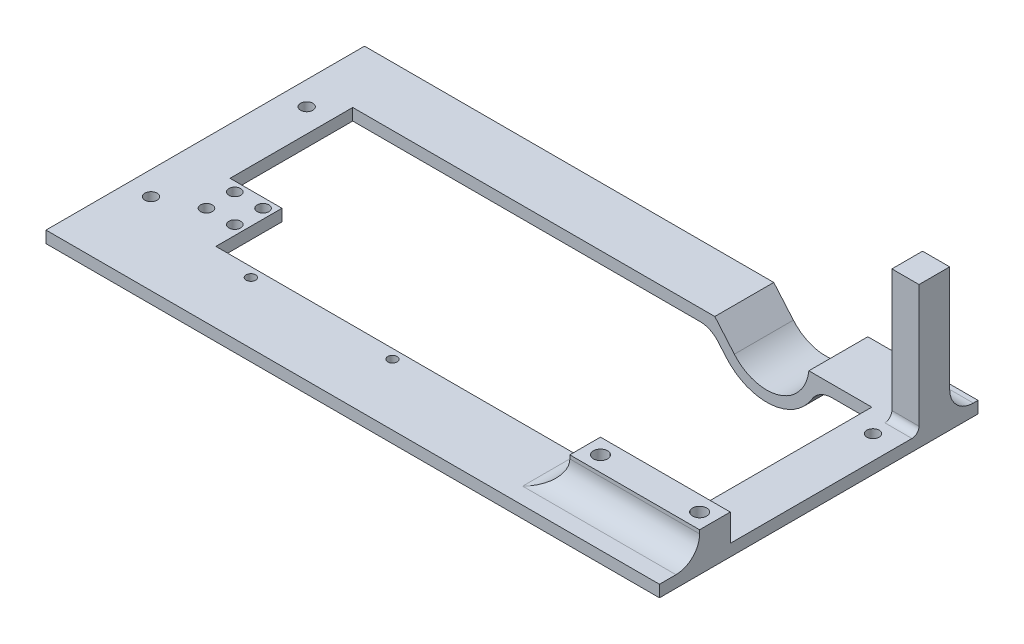
from build123d import *

# Parameters (mm, degrees)
BOSS_EXTRUDE1_DEPTH = 5
SKETCH2_W           = 55
SKETCH2_H           = 13
SKETCH2_R           = 3
BOSS_EXTRUDE2_DEPTH = 11.5
SKETCH3_W           = 11.5
SKETCH3_H           = 13
BOSS_EXTRUDE3_DEPTH = 55
BOSS_EXTRUDE4_DEPTH = 60
CUT_EXTRUDE1_DEPTH  = 35
SKETCH6_R           = 2.5
SKETCH6_R_2         = 2
CUT_EXTRUDE2_DEPTH  = 10
SKETCH7_R           = 2.6
CUT_EXTRUDE3_DEPTH  = 10
SKETCH8_R           = 3
CUT_EXTRUDE4_DEPTH  = 6
FILLET1_R           = 10
FILLET2_R           = 3
FILLET3_R           = 10


with BuildPart() as part:
    # Sketch1 → Boss-Extrude1 (new body)
    with BuildSketch(Plane(origin=(0, 0, 0), x_dir=(1, 0, 0), z_dir=(0, 1, 0))):
        Polygon((130, 85), (90, 85), (90, 25), (110, 25), (110, -55), (-88, -55), (-88, -27), (-110, -27), (-110, 85), (-130, 85), (-130, -85), (130, -85), align=None)
    extrude(amount=BOSS_EXTRUDE1_DEPTH)

    # Sketch2 → Boss-Extrude2 (add)
    with BuildSketch(Plane(origin=(0, 5, 0), x_dir=(1, 0, 0), z_dir=(0, 1, 0))):
        with Locations((102.5, -61.5)):
            Rectangle(SKETCH2_W, SKETCH2_H)
        with Locations((81.5, -61.5)):
            Circle(SKETCH2_R, mode=Mode.SUBTRACT)
        with Locations((123.5, -61.5)):
            Circle(SKETCH2_R, mode=Mode.SUBTRACT)
    extrude(amount=BOSS_EXTRUDE2_DEPTH)

    # Sketch3 → Boss-Extrude3 (add)
    with BuildSketch(Plane(origin=(0, 5, 0), x_dir=(1, 0, 0), z_dir=(0, 1, 0))):
        with Locations((124.25, 31.5)):
            Rectangle(SKETCH3_W, SKETCH3_H)
    extrude(amount=BOSS_EXTRUDE3_DEPTH)

    # Sketch4 → Boss-Extrude4 (add)
    with BuildSketch(Plane(origin=(0, 0, -85), x_dir=(-1, 0, 0), z_dir=(0, 0, -1))):
        with BuildLine():
            Line((-90, 5), (-83.30854382, 5))
            ThreePointArc((-83.30854382, 5), (-70.704531681, -10.206792987), (-51.737752976, -4.695987191))
            Line((-51.737752976, -4.695987191), (-43.449337938, 5))
            Line((-43.449337938, 5), (110, 5))
            Line((110, 5), (130, 5))
            Line((130, 5), (130, 0))
            Line((130, 0), (110, 0))
            Line((110, 0), (-41.80340478, 0))
            Line((-41.80340478, 0), (-48.31719122, -7.619983989))
            ThreePointArc((-48.31719122, -7.619983989), (-69.790001662, -15.071544701), (-86.80340478, 0))
            Line((-86.80340478, 0), (-90, 0))
            Line((-90, 0), (-130, 0))
            Line((-130, 0), (-130, 5))
            Line((-130, 5), (-90, 5))
        make_face()
    extrude(amount=-BOSS_EXTRUDE4_DEPTH)

    # Sketch5 → Cut-Extrude1 (cut)
    with BuildSketch(Plane(origin=(0, 0, -85), x_dir=(-1, 0, 0), z_dir=(0, 0, -1))):
        with BuildLine():
            Line((130, 5), (130, 0))
            Line((130, 0), (-41.80340478, 0))
            Line((-41.80340478, 0), (-48.31719122, -7.619983989))
            ThreePointArc((-48.31719122, -7.619983989), (-69.790001662, -15.071544701), (-86.80340478, 0))
            Line((-86.80340478, 0), (-130, 0))
            Line((-130, 0), (-130, 5))
            Line((-130, 5), (-83.30854382, 5))
            ThreePointArc((-83.30854382, 5), (-70.704531681, -10.206792987), (-51.737752976, -4.695987191))
            Line((-51.737752976, -4.695987191), (-43.449337938, 5))
            Line((-43.449337938, 5), (130, 5))
        make_face()
    extrude(amount=-CUT_EXTRUDE1_DEPTH, mode=Mode.SUBTRACT)

    # Sketch6 → Cut-Extrude2 (cut)
    with BuildSketch(Plane(origin=(0, 5, 0), x_dir=(1, 0, 0), z_dir=(0, 1, 0))):
        with Locations((-104, -31)):
            Circle(SKETCH6_R)
        with Locations((-92, -31)):
            Circle(SKETCH6_R)
        with Locations((-92, -43)):
            Circle(SKETCH6_R)
        with Locations((-104, -43)):
            Circle(SKETCH6_R)
        with Locations((-9.17, -59)):
            Circle(SKETCH6_R_2)
        with Locations((-69.17, -59)):
            Circle(SKETCH6_R_2)
    extrude(amount=-CUT_EXTRUDE2_DEPTH, mode=Mode.SUBTRACT)

    # Sketch7 → Cut-Extrude3 (cut)
    with BuildSketch(Plane(origin=(0, 5, 0), x_dir=(1, 0, 0), z_dir=(0, 1, 0))):
        with Locations((120, 15.5)):
            Circle(SKETCH7_R)
        with Locations((120, -50.5)):
            Circle(SKETCH7_R)
        with Locations((-120, -50.5)):
            Circle(SKETCH7_R)
        with Locations((-120, 15.5)):
            Circle(SKETCH7_R)
    extrude(amount=-CUT_EXTRUDE3_DEPTH, mode=Mode.SUBTRACT)

    # Sketch8 → Cut-Extrude4 (cut)
    with BuildSketch(Plane.ZY.offset(-118.5)):
        with Locations((-31.5, 53.5)):
            Circle(SKETCH8_R)
        with Locations((-31.5, 11.5)):
            Circle(SKETCH8_R)
    extrude(amount=-CUT_EXTRUDE4_DEPTH, mode=Mode.SUBTRACT)

    # Fillet1
    fillet1_edges = [part.edges().sort_by_distance(p)[0] for p in [
        (124.25, 5, -38),
        (75, 5, 61.5),
        (102.5, 5, 68),
    ]]
    fillet(fillet1_edges, radius=FILLET1_R)

    # Fillet2
    fillet2_edges = [part.edges().sort_by_distance(p)[0] for p in [
        (124.25, 5, -25),
    ]]
    fillet(fillet2_edges, radius=FILLET2_R)

    # Fillet3
    fillet3_edges = [part.edges().sort_by_distance(p)[0] for p in [
        (41.80340478, 0, -37.5),
        (86.80340478, 0, -37.5),
    ]]
    fillet(fillet3_edges, radius=FILLET3_R)


solid = part.part
